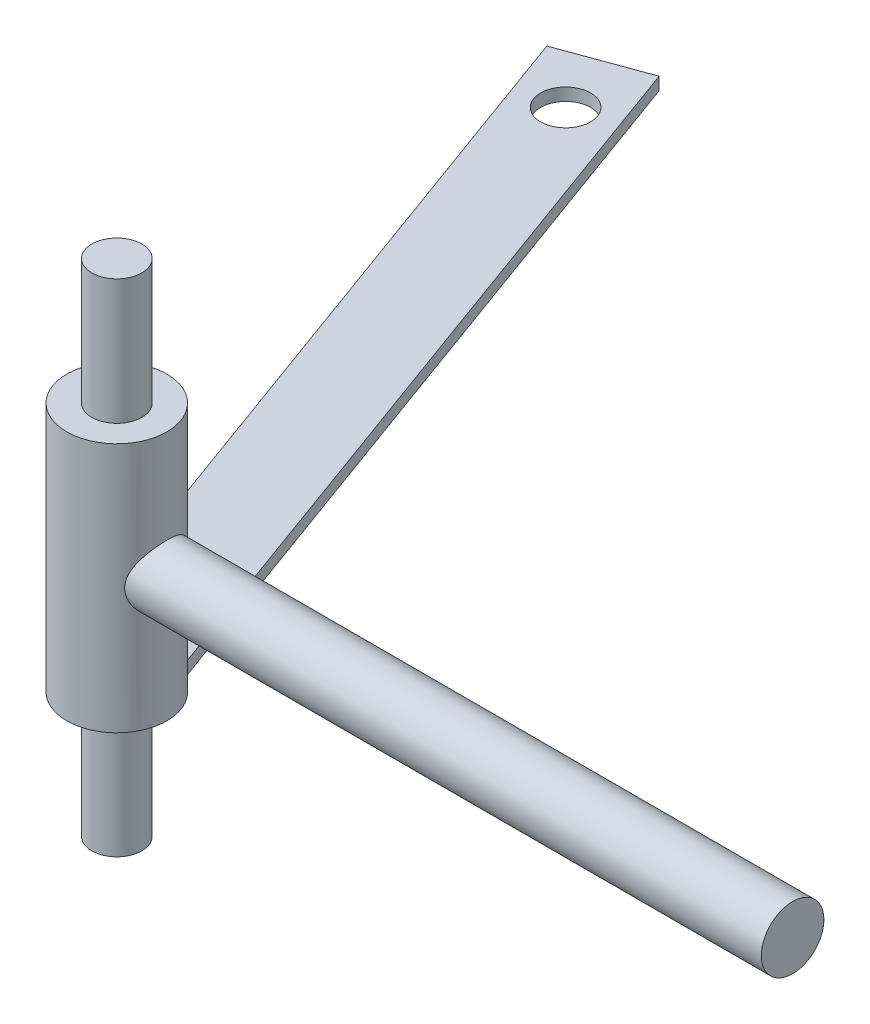
from build123d import *

# Parameters (mm, degrees)
SKETCH1_R           = 4
BOSS_EXTRUDE1_DEPTH = 40
SKETCH3_R           = 8
BOSS_EXTRUDE2_DEPTH = 20
SKETCH4_R           = 5
BOSS_EXTRUDE3_DEPTH = 108
SKETCH5_W           = 14
SKETCH5_H           = 2
BOSS_EXTRUDE4_DEPTH = 130
CUT_EXTRUDE1_REACH  = 176.108
SKETCH6_R           = 4


with BuildPart() as part:
    # Sketch1 → Boss-Extrude1 (new, symmetric)
    with BuildSketch(Plane(origin=(0, 0, 0), x_dir=(1, 0, 0), z_dir=(0, 1, 0))):
        Circle(SKETCH1_R)
    extrude(amount=BOSS_EXTRUDE1_DEPTH, both=True)

    # Sketch3 → Boss-Extrude2 (add, symmetric)
    with BuildSketch(Plane(origin=(0, 0, 0), x_dir=(1, 0, 0), z_dir=(0, 1, 0))):
        Circle(SKETCH3_R)
    extrude(amount=BOSS_EXTRUDE2_DEPTH, both=True)

    # Sketch4 → Boss-Extrude3 (add)
    with BuildSketch(Plane(origin=(0, 0, 0), x_dir=(0, 0, -1), z_dir=(1, 0, 0))):
        Circle(SKETCH4_R)
    extrude(amount=BOSS_EXTRUDE3_DEPTH)

    # Sketch5 → Boss-Extrude4 (add)
    with BuildSketch(Plane(origin=(0, 0, 0), x_dir=(0.9396926207859081, 0, -0.34202014332566943), z_dir=(0.34202014332566943, 0, 0.9396926207859081))):
        with Locations((0, -17)):
            Rectangle(SKETCH5_W, SKETCH5_H)
    extrude(amount=-BOSS_EXTRUDE4_DEPTH)

    # Sketch6 → Cut-Extrude1 (cut, up to next)
    with BuildSketch(Plane(origin=(0, -16, 0), x_dir=(1, 0, 0), z_dir=(0, 1, 0)), mode=Mode.PRIVATE) as cut_extrude1_sk1:
        with Locations((-41.042417199, 112.763114494)):
            Circle(SKETCH6_R)
    cut_extrude1_tool1 = extrude(cut_extrude1_sk1.sketch, amount=-CUT_EXTRUDE1_REACH, mode=Mode.PRIVATE) & part.part
    add(cut_extrude1_tool1.solids().sort_by_distance((-41.042417, -16, -112.763114))[0], mode=Mode.SUBTRACT)


solid = part.part
